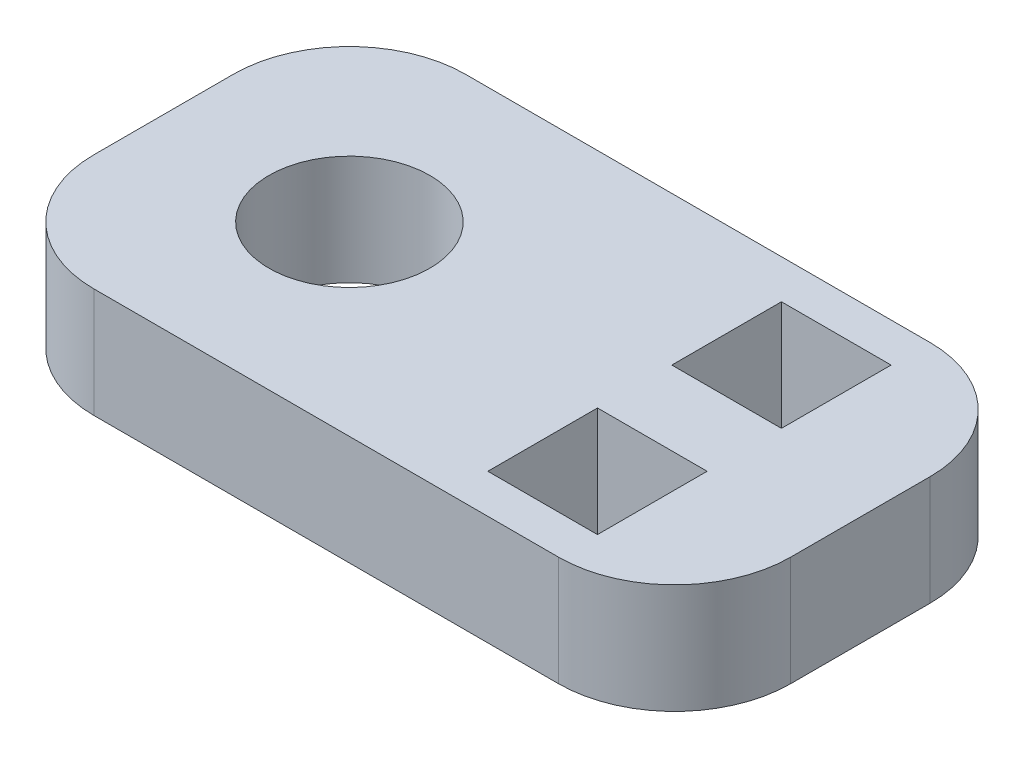
from build123d import *

# Parameters (mm, degrees)
SKETCH1_W           = 19.05
SKETCH1_H           = 10.16
SKETCH1_R           = 2.2
SKETCH1_W_2         = 2.9972
SKETCH1_H_2         = 2.9972
BOSS_EXTRUDE1_DEPTH = 2.9972
FILLET1_R           = 3.175


with BuildPart() as part:
    # Sketch1 → Boss-Extrude1 (new body)
    with BuildSketch(Plane(origin=(0, 0, 0), x_dir=(1, 0, 0), z_dir=(0, 1, 0))):
        with Locations((9.525, 5.08)):
            Rectangle(SKETCH1_W, SKETCH1_H)
        with Locations(Location((5.08, 5.08, 0), (0, 0, 90))):
            Circle(SKETCH1_R, mode=Mode.SUBTRACT)
        with Locations((14.3764, 2.5654)):
            Rectangle(SKETCH1_W_2, SKETCH1_H_2, mode=Mode.SUBTRACT)
        with Locations((14.3764, 7.5946)):
            Rectangle(SKETCH1_W_2, SKETCH1_H_2, mode=Mode.SUBTRACT)
    extrude(amount=BOSS_EXTRUDE1_DEPTH)

    # Fillet1
    fillet1_edges = [part.edges().sort_by_distance(p)[0] for p in [
        (0, 1.4986, -10.16),
        (19.05, 1.4986, -10.16),
        (19.05, 1.4986, 0),
        (0, 1.4986, 0),
    ]]
    fillet(fillet1_edges, radius=FILLET1_R)


solid = part.part
